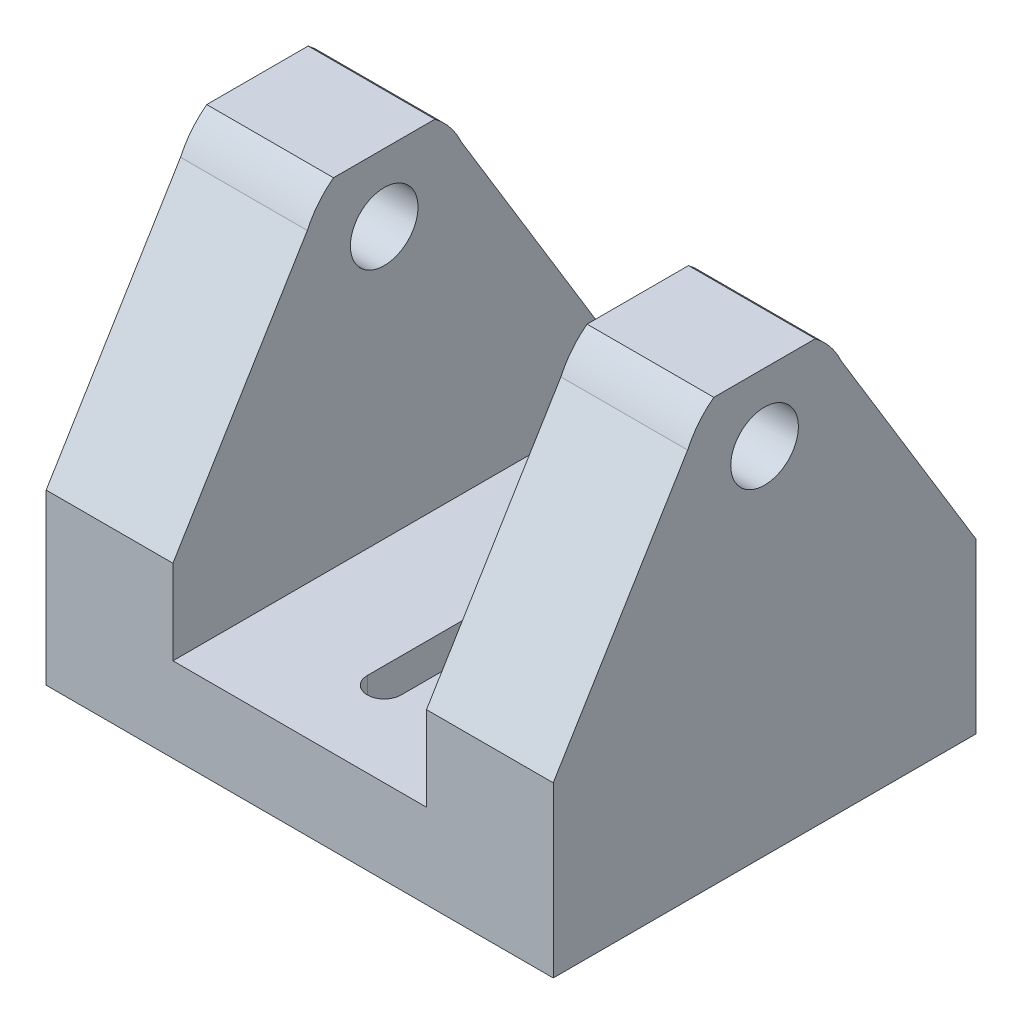
from build123d import *

# Parameters (mm, degrees)
SKETCH1_W                = 76.2
SKETCH1_H                = 63.5
BOSS_EXTRUDE2_DEPTH      = 63.5
SKETCH6_W                = 38.1
SKETCH6_H                = 50.8
CUT_EXTRUDE4_DEPTH       = 63.5
CUT_EXTRUDE6_DEPTH       = 118.774954893
CUT_EXTRUDE6_DEPTH_BACK  = 118.774954893
SKETCH9_R                = 5.08
CUT_EXTRUDE7_DEPTH       = 118.774954893
CUT_EXTRUDE10_DEPTH      = 118.774954893
CUT_EXTRUDE15_DEPTH      = 118.774954893
CUT_EXTRUDE15_DEPTH_BACK = 118.774954893


with BuildPart() as part:
    # Sketch1 → Boss-Extrude2 (new body)
    with BuildSketch(Plane(origin=(0, 0, 0), x_dir=(1, 0, 0), z_dir=(0, 1, 0))):
        with Locations((38.1, 31.75)):
            Rectangle(SKETCH1_W, SKETCH1_H)
    boss_extrude2 = extrude(amount=BOSS_EXTRUDE2_DEPTH)

    # Sketch6 → Cut-Extrude4 (cut)
    with BuildSketch(Plane.XY):
        with Locations((38.1, 38.1)):
            Rectangle(SKETCH6_W, SKETCH6_H)
    cut_extrude4 = extrude(amount=-CUT_EXTRUDE4_DEPTH, mode=Mode.SUBTRACT)

    # Sketch7 → Cut-Extrude6 (cut, two sides: drawn at the far end of the back side and taken through both)
    with BuildSketch(Plane(origin=(0, 0, 0), x_dir=(1, 0, 0), z_dir=(0, 1, 0)).offset(-CUT_EXTRUDE6_DEPTH_BACK)):
        Polygon((38.1, -158.106178129), (38.1, 0), (38.1, 63.5), (38.1, 221.606178129), (354.312356258, 221.606178129), (354.312356258, -158.106178129), align=None)
    extrude(amount=CUT_EXTRUDE6_DEPTH + CUT_EXTRUDE6_DEPTH_BACK, mode=Mode.SUBTRACT)

    # Mirror3: Boss-Extrude2, Cut-Extrude4 across plane
    add(boss_extrude2.mirror(Plane(origin=(38.1, 226.593693616, 0), x_dir=(0, 0, 1), z_dir=(-1, 0, 0))))
    add(cut_extrude4.mirror(Plane(origin=(38.1, 226.593693616, 0), x_dir=(0, 0, 1), z_dir=(-1, 0, 0))), mode=Mode.SUBTRACT)

    # Sketch9 → Cut-Extrude7 (cut, through all)
    with BuildSketch(Plane.ZY):
        with Locations((-31.75, 53.34)):
            Circle(SKETCH9_R)
    extrude(amount=-CUT_EXTRUDE7_DEPTH, mode=Mode.SUBTRACT)

    # Sketch10 → Cut-Extrude10 (cut, through all)
    with BuildSketch(Plane.ZY):
        with BuildLine():
            Line((-63.5, 63.5), (-63.5, 25.4))
            Line((-63.5, 25.4), (-43.307, 58.60552476))
            ThreePointArc((-43.307, 58.60552476), (-41.64587309, 61.300006016), (-39.37, 63.5))
            Line((-39.37, 63.5), (-63.5, 63.5))
        make_face()
        with BuildLine():
            ThreePointArc((-24.13, 63.5), (-21.85412691, 61.300006016), (-20.193, 58.60552476))
            Line((-20.193, 58.60552476), (0, 25.4))
            Line((0, 25.4), (0, 63.5))
            Line((0, 63.5), (-24.13, 63.5))
        make_face()
    extrude(amount=-CUT_EXTRUDE10_DEPTH, mode=Mode.SUBTRACT)

    # Sketch11 → Cut-Extrude15 (cut, two sides: drawn at the far end of the back side and taken through both)
    with BuildSketch(Plane(origin=(0, 0, 0), x_dir=(1, 0, 0), z_dir=(0, 1, 0)).offset(-CUT_EXTRUDE15_DEPTH_BACK)):
        with BuildLine():
            Line((40.64, 50.8), (40.64, 12.7))
            ThreePointArc((40.64, 12.7), (38.1, 10.16), (35.56, 12.7))
            Line((35.56, 12.7), (35.56, 50.8))
            ThreePointArc((35.56, 50.8), (38.1, 53.34), (40.64, 50.8))
        make_face()
    extrude(amount=CUT_EXTRUDE15_DEPTH + CUT_EXTRUDE15_DEPTH_BACK, mode=Mode.SUBTRACT)


solid = part.part
